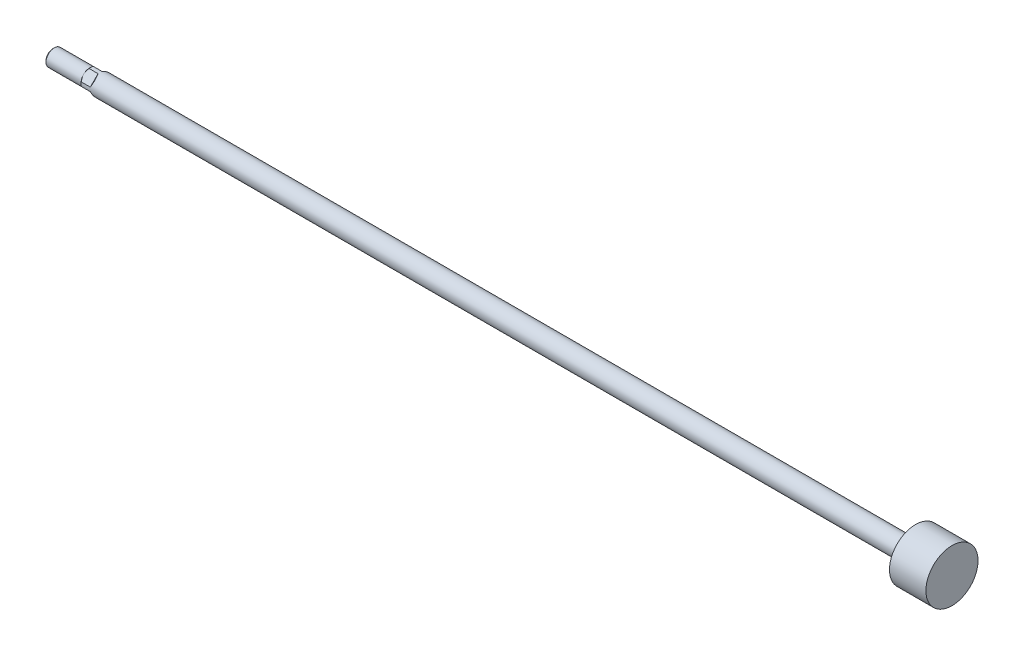
from build123d import *

# Parameters (mm, degrees)
CUT_EXTRUDE_1_DEPTH      = 5
CUT_EXTRUDE_1_DEPTH_BACK = 5
CUT_EXTRUDE_2_DEPTH      = 5
CUT_EXTRUDE_2_DEPTH_BACK = 5


with BuildPart() as part:
    # 草图1 → 旋转1 (revolve)
    with BuildSketch(Plane.XY):
        Polygon((0, 0), (0, 4.233), (0.767, 5), (22, 5), (23, 6), (521, 6), (521, 15.75), (543, 15.75), (543, 0), align=None)
    revolve(axis=Axis((543, 0, 0), (-1, 0, 0)))

    # 草图2 → 切除-拉伸1 (cut, two sides: drawn at the far end of the back side and taken through both)
    with BuildSketch(Plane(origin=(0, 0, 0), x_dir=(1, 0, 0), z_dir=(0, -0.7071067811865477, 0.7071067811865475)).offset(-CUT_EXTRUDE_1_DEPTH_BACK)):
        Polygon((-5, -12), (35.4, -12), (28.4, -5), (22, -5), (19.8, -7.2), (19.8, -10), (-3, -10), (-3, 10), (19.8, 10), (19.8, 7.2), (22, 5), (28.4, 5), (35.4, 12), (-5, 12), align=None)
    extrude(amount=CUT_EXTRUDE_1_DEPTH + CUT_EXTRUDE_1_DEPTH_BACK, mode=Mode.SUBTRACT)

    # 草图3 → 切除-拉伸2 (cut, two sides: drawn at the far end of the back side and taken through both)
    with BuildSketch(Plane(origin=(0, 0, 0), x_dir=(-1, 0, 0), z_dir=(0, -0.7071067811865477, -0.7071067811865475)).offset(-CUT_EXTRUDE_2_DEPTH_BACK)):
        Polygon((5, 12), (-35.4, 12), (-28.4, 5), (-22, 5), (-19.8, 7.2), (-19.8, 10), (3, 10), (3, -10), (-19.8, -10), (-19.8, -7.2), (-22, -5), (-28.4, -5), (-35.4, -12), (5, -12), align=None)
    extrude(amount=CUT_EXTRUDE_2_DEPTH + CUT_EXTRUDE_2_DEPTH_BACK, mode=Mode.SUBTRACT)


solid = part.part
